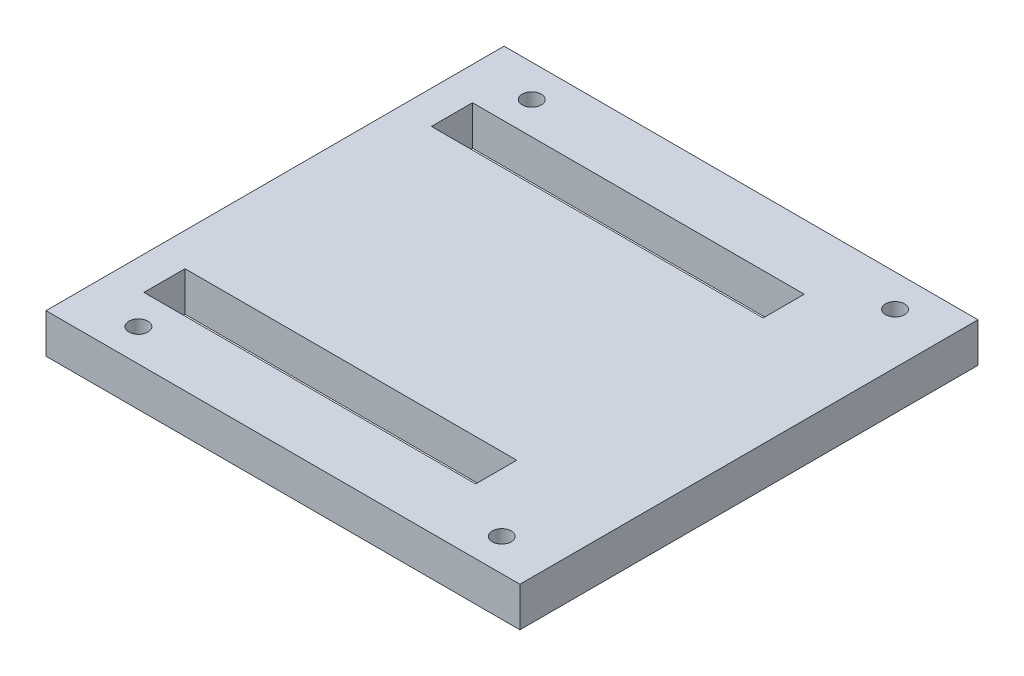
from build123d import *

# Parameters (mm, degrees)
SKETCH_1_W          = 30
SKETCH_1_H          = 29
SKETCH_1_W_2        = 21
SKETCH_1_H_2        = 2.6
EXTRUDE_1_DEPTH     = 2.5
SKETCH_2_R          = 0.6
CUT_EXTRUDE_1_DEPTH = 22.011901389
SKETCH_2_3_R        = 1
SKETCH_2_3_R_2      = 0.6
CUT_EXTRUDE_2_DEPTH = 1.5


with BuildPart() as part:
    # 草图1 → 凸台-拉伸1 (new body)
    with BuildSketch(Plane(origin=(0, 0, 0), x_dir=(1, 0, 0), z_dir=(0, 1, 0))):
        Rectangle(SKETCH_1_W, SKETCH_1_H)
        with Locations((-2.4, 9.1)):
            Rectangle(SKETCH_1_W_2, SKETCH_1_H_2, mode=Mode.SUBTRACT)
        with Locations((-2.4, -9.1)):
            Rectangle(SKETCH_1_W_2, SKETCH_1_H_2, mode=Mode.SUBTRACT)
    extrude(amount=EXTRUDE_1_DEPTH)

    # 草图2 → 切除-拉伸1 (cut, through all)
    with BuildSketch(Plane.XZ):
        with Locations((-11.2, -12.45)):
            Circle(SKETCH_2_R)
        with Locations((-11.2, 12.45)):
            Circle(SKETCH_2_R)
        with Locations((11.8, 12.45)):
            Circle(SKETCH_2_R)
        with Locations((11.8, -12.45)):
            Circle(SKETCH_2_R)
    extrude(amount=-CUT_EXTRUDE_1_DEPTH, mode=Mode.SUBTRACT)

    # 草图2<3> → 切除-拉伸2 (cut)
    # profile 1 of 4: a face of its own
    with BuildSketch(Plane.XZ):
        with Locations((-11.2, -12.45)):
            Circle(SKETCH_2_3_R)
        with Locations((-11.2, -12.45)):
            Circle(SKETCH_2_3_R_2, mode=Mode.SUBTRACT)
    # profile 2 of 4: a face of its own
    with BuildSketch(Plane.XZ):
        with Locations((-11.2, 12.45)):
            Circle(SKETCH_2_3_R)
        with Locations((-11.2, 12.45)):
            Circle(SKETCH_2_3_R_2, mode=Mode.SUBTRACT)
    # profile 3 of 4: a face of its own
    with BuildSketch(Plane.XZ):
        with Locations((11.8, 12.45)):
            Circle(SKETCH_2_3_R)
        with Locations((11.8, 12.45)):
            Circle(SKETCH_2_3_R_2, mode=Mode.SUBTRACT)
    # profile 4 of 4: a face of its own
    with BuildSketch(Plane.XZ):
        with Locations((11.8, -12.45)):
            Circle(SKETCH_2_3_R)
        with Locations((11.8, -12.45)):
            Circle(SKETCH_2_3_R_2, mode=Mode.SUBTRACT)
    extrude(amount=-CUT_EXTRUDE_2_DEPTH, mode=Mode.SUBTRACT)


solid = part.part
